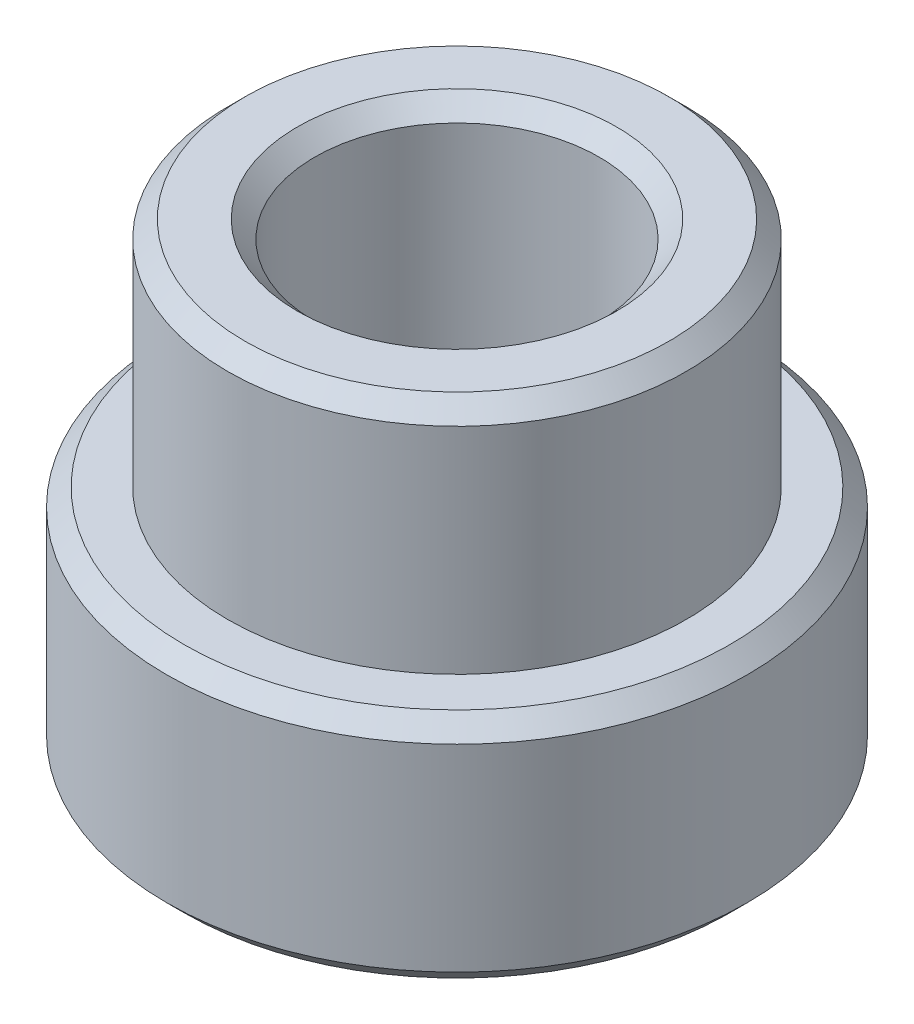
from build123d import *

# Parameters (mm, degrees)
SKETCH1_R           = 5
SKETCH1_R_2         = 2.45
BOSS_EXTRUDE1_DEPTH = 8
SKETCH2_R           = 10
SKETCH2_R_2         = 3.95
CUT_EXTRUDE1_DEPTH  = 4
CHAMFER1_SIZE       = 0.3


with BuildPart() as part:
    # Sketch1 → Boss-Extrude1 (new body)
    with BuildSketch(Plane(origin=(0, 0, 0), x_dir=(1, 0, 0), z_dir=(0, 1, 0))):
        with Locations(Location((0, 0, 0), (0, 0, 270))):
            Circle(SKETCH1_R)
        with Locations(Location((0, 0, 0), (0, 0, 270))):
            Circle(SKETCH1_R_2, mode=Mode.SUBTRACT)
    extrude(amount=BOSS_EXTRUDE1_DEPTH)

    # Sketch2 → Cut-Extrude1 (cut)
    with BuildSketch(Plane(origin=(0, 8, 0), x_dir=(1, 0, 0), z_dir=(0, 1, 0))):
        Circle(SKETCH2_R)
        with Locations(Location((0, 0, 0), (0, 0, 270))):
            Circle(SKETCH2_R_2, mode=Mode.SUBTRACT)
    extrude(amount=-CUT_EXTRUDE1_DEPTH, mode=Mode.SUBTRACT)

    # Chamfer1
    chamfer1_edges = [part.edges().sort_by_distance(p)[0] for p in [
        (0, 8, -3.95),
        (0, 4, -5),
        (0, 0, -5),
        (0, 0, -2.45),
        (0, 8, -2.45),
    ]]
    chamfer(chamfer1_edges, length=CHAMFER1_SIZE)


solid = part.part
